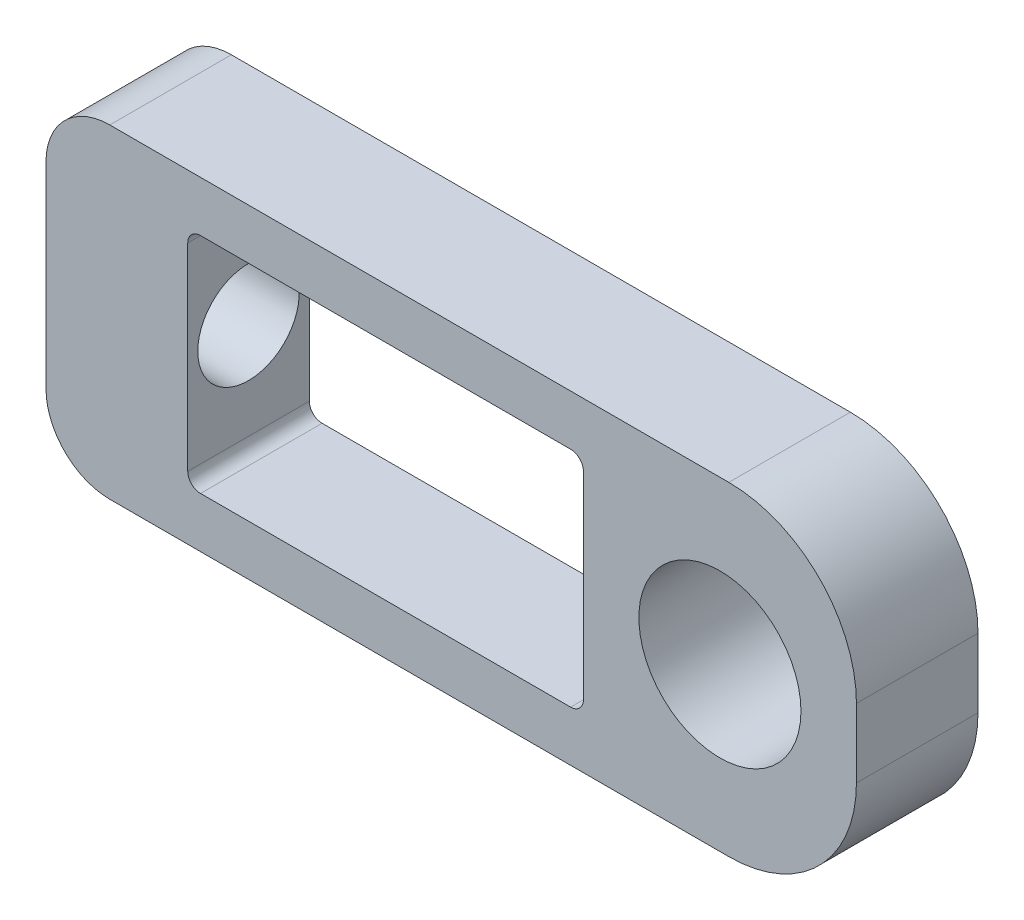
from build123d import *

# Parameters (mm, degrees)
SKETCH1_W           = 63.5
SKETCH1_H           = 25.4
BOSS_EXTRUDE1_DEPTH = 9.525
SKETCH5_R           = 6.35
SKETCH5_W           = 31
SKETCH5_H           = 17.5
CUT_EXTRUDE3_DEPTH  = 70.051688068
CUT_EXTRUDE2_REACH  = 71.052
SKETCH4_R           = 3.9751
FILLET4_R           = 10
FILLET5_R           = 5
FILLET6_R           = 1


with BuildPart() as part:
    # Sketch1 → Boss-Extrude1 (new body)
    with BuildSketch(Plane.XY):
        with Locations((31.75, 12.7)):
            Rectangle(SKETCH1_W, SKETCH1_H)
    extrude(amount=BOSS_EXTRUDE1_DEPTH)

    # Sketch5 → Cut-Extrude3 (cut, through all)
    with BuildSketch(Plane.XY.offset(9.525)):
        with Locations((52.803125, 12.7)):
            Circle(SKETCH5_R)
        with Locations((26.60625, 12.7)):
            Rectangle(SKETCH5_W, SKETCH5_H)
    extrude(amount=-CUT_EXTRUDE3_DEPTH, mode=Mode.SUBTRACT)

    # Sketch4 → Cut-Extrude2 (cut, up to next)
    with BuildSketch(Plane.ZY, mode=Mode.PRIVATE) as cut_extrude2_sk1:
        with Locations((4.7625, 12.7)):
            Circle(SKETCH4_R)
    cut_extrude2_tool1 = extrude(cut_extrude2_sk1.sketch, amount=-CUT_EXTRUDE2_REACH, mode=Mode.PRIVATE) & part.part
    add(cut_extrude2_tool1.solids().sort_by_distance((0, 12.7, 4.7625))[0], mode=Mode.SUBTRACT)

    # Fillet4
    fillet4_edges = [part.edges().sort_by_distance(p)[0] for p in [
        (63.5, 25.4, 4.7625),
        (63.5, 0, 4.7625),
    ]]
    fillet(fillet4_edges, radius=FILLET4_R)

    # Fillet5
    fillet5_edges = [part.edges().sort_by_distance(p)[0] for p in [
        (0, 25.4, 4.7625),
        (0, 0, 4.7625),
    ]]
    fillet(fillet5_edges, radius=FILLET5_R)

    # Fillet6
    fillet6_edges = [part.edges().sort_by_distance(p)[0] for p in [
        (42.10625, 21.45, 4.7625),
        (42.10625, 3.95, 4.7625),
        (11.10625, 3.95, 4.7625),
        (11.10625, 21.45, 4.7625),
    ]]
    fillet(fillet6_edges, radius=FILLET6_R)


solid = part.part
